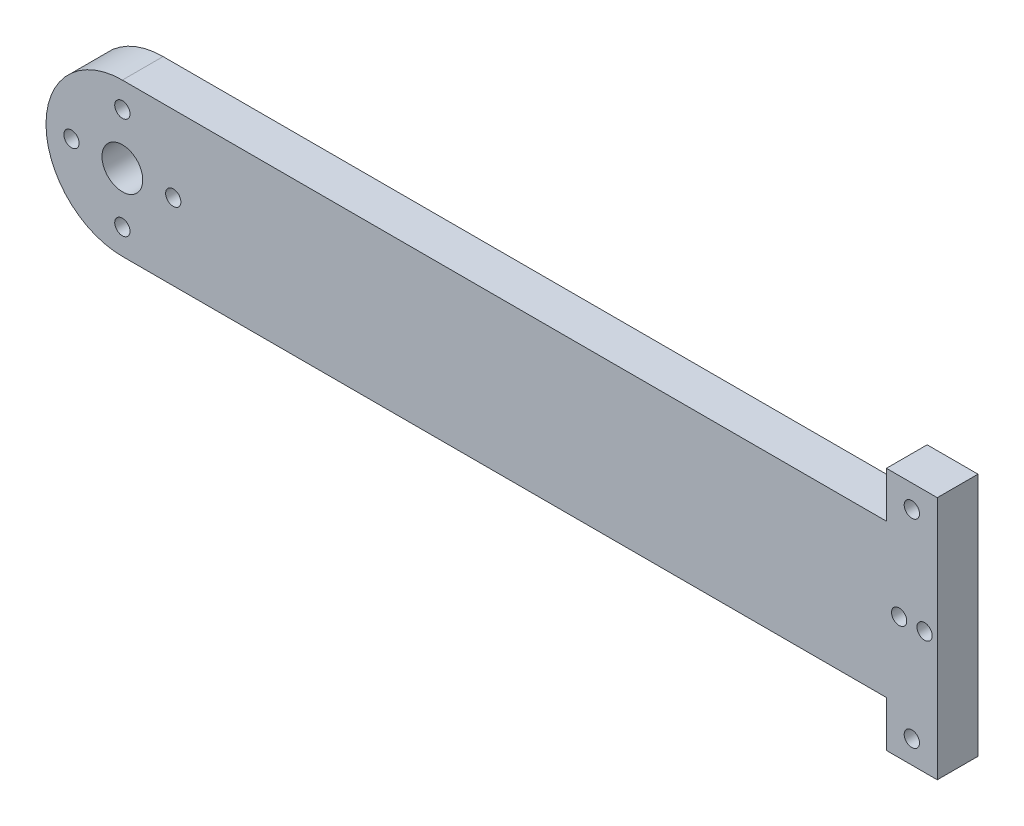
from build123d import *

# Parameters (mm, degrees)
BOSS_EXTRUDE1_DEPTH     = 8
CUT_EXTRUDE6_DEPTH      = 169.285043392
CUT_EXTRUDE6_DEPTH_BACK = 8
SKETCH6_R               = 4.004848267
SKETCH6_R_2             = 1.500740619
SKETCH6_R_3             = 1.502884449
SKETCH6_R_4             = 1.495453733
SKETCH6_R_5             = 1.501499852
SKETCH6_R_6             = 1.504449493
SKETCH6_R_7             = 1.503694776
SKETCH6_R_8             = 1.495371025
SKETCH6_R_9             = 1.497490914


with BuildPart() as part:
    # Sketch5 → Boss-Extrude1 (new body)
    with BuildSketch(Plane.XY):
        with BuildLine():
            Line((0, -42.218893529), (150.106998899, -42.218893529))
            Line((150.106998899, -42.218893529), (150.106998899, -51.223119472))
            Line((150.106998899, -51.223119472), (155.102889251, -51.223119472))
            Line((155.102889251, -51.223119472), (160.100118241, -51.223119472))
            Line((160.100118241, -51.223119472), (160.100118241, -3.214680099))
            Line((160.100118241, -3.214680099), (155.102889251, -3.214680099))
            Line((155.102889251, -3.214680099), (150.106998899, -3.214680099))
            Line((150.106998899, -3.214680099), (150.106998899, -12.215396897))
            Line((150.106998899, -12.215396897), (0, -12.215396897))
            ThreePointArc((0, -12.215396897), (-15.001748316, -27.217145213), (0, -42.218893529))
        make_face()
    extrude(amount=BOSS_EXTRUDE1_DEPTH)

    # Sketch6 → Cut-Extrude6 (cut, two sides: drawn at the far end of the back side and taken through both)
    with BuildSketch(Plane.XY.offset(-CUT_EXTRUDE6_DEPTH_BACK)):
        with Locations((0, -27.217145213)):
            Circle(SKETCH6_R)
        with Locations((0, -37.213991998)):
            Circle(SKETCH6_R_2)
        with Locations((0, -17.219491861)):
            Circle(SKETCH6_R_3)
        with Locations((9.996605481, -27.217145213)):
            Circle(SKETCH6_R_4)
        with Locations((-9.995878708, -27.217145213)):
            Circle(SKETCH6_R_5)
        with Locations((155.102889251, -46.721006501)):
            Circle(SKETCH6_R_6)
        with Locations((155.102889251, -7.715038498)):
            Circle(SKETCH6_R_7)
        with Locations((152.604944075, -27.217145213)):
            Circle(SKETCH6_R_8)
        with Locations((157.601503746, -27.217145213)):
            Circle(SKETCH6_R_9)
    extrude(amount=CUT_EXTRUDE6_DEPTH + CUT_EXTRUDE6_DEPTH_BACK, mode=Mode.SUBTRACT)


solid = part.part
